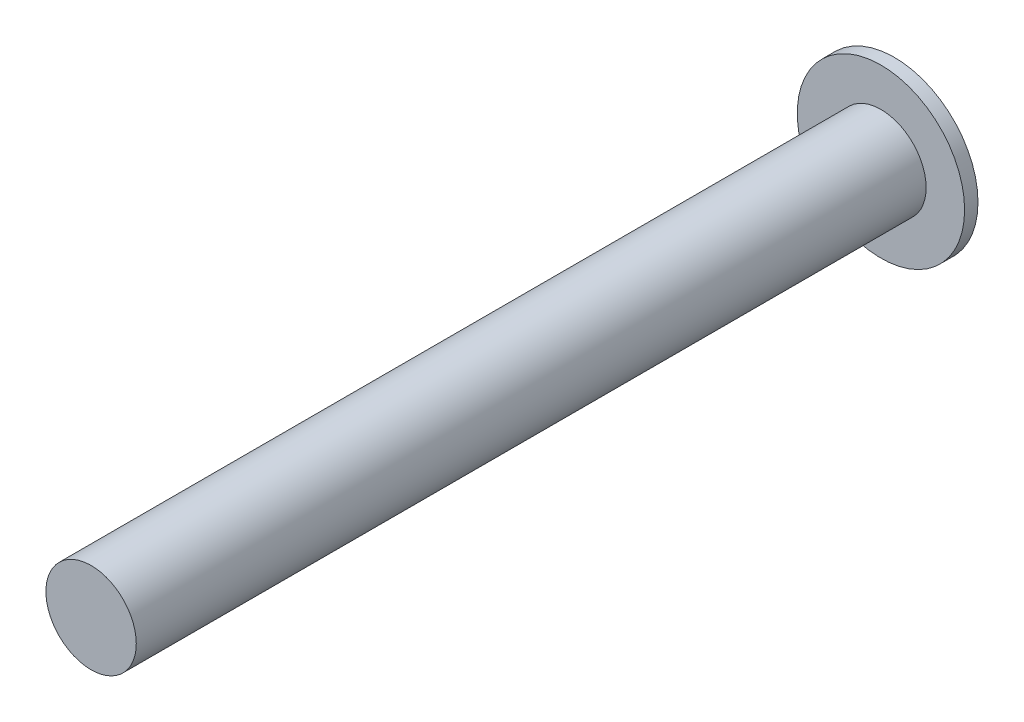
from build123d import *

# Parameters (mm, degrees)
SKETCH1_R           = 12.5
SKETCH1_R_2         = 6.75
BOSS_EXTRUDE1_DEPTH = 2
SKETCH1_3_R         = 6.75
BOSS_EXTRUDE2_DEPTH = 120
SKETCH1_4_R         = 5.75
CUT_EXTRUDE1_DEPTH  = 115
SKETCH2_W           = 5.5
SKETCH2_H           = 5.53257791
CUT_EXTRUDE3_DEPTH  = 80


with BuildPart() as part:
    # Sketch1 → Boss-Extrude1 (new body)
    with BuildSketch(Plane.XY):
        Circle(SKETCH1_R)
        Circle(SKETCH1_R_2, mode=Mode.SUBTRACT)
    extrude(amount=BOSS_EXTRUDE1_DEPTH)

    # Sketch1<3> → Boss-Extrude2 (add)
    with BuildSketch(Plane.XY):
        Circle(SKETCH1_3_R)
    extrude(amount=BOSS_EXTRUDE2_DEPTH)

    # Sketch1<4> → Cut-Extrude1 (cut)
    with BuildSketch(Plane.XY):
        Circle(SKETCH1_4_R)
    extrude(amount=CUT_EXTRUDE1_DEPTH, mode=Mode.SUBTRACT)

    # Sketch2 → Cut-Extrude3 (cut)
    with BuildSketch(Plane.XY.offset(10)):
        with Locations((0, -6.75)):
            Rectangle(SKETCH2_W, SKETCH2_H)
    extrude(amount=CUT_EXTRUDE3_DEPTH, mode=Mode.SUBTRACT)


solid = part.part
